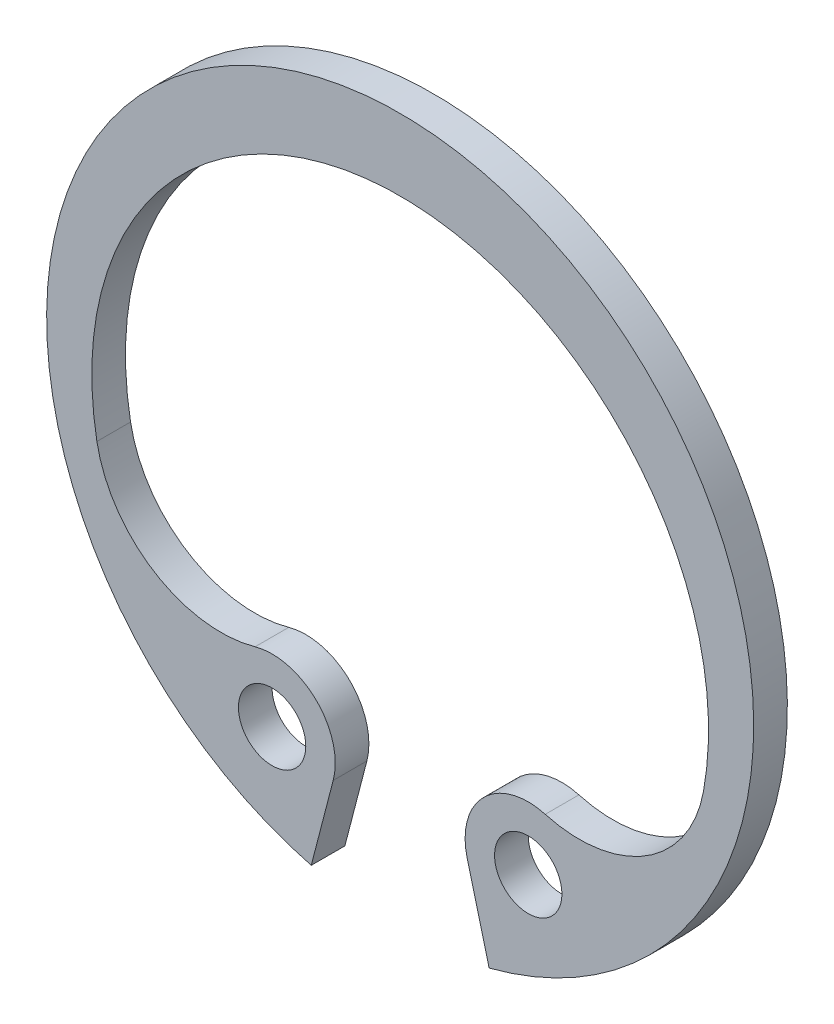
from build123d import *

# Parameters (mm, degrees)
BODYSKE_R  = 0.4
BODY_DEPTH = 0.4


with BuildPart() as part:
    # BodySke → Body (new body)
    with BuildSketch(Plane.XY):
        with BuildLine():
            Line((1.056664408, -4.064905943), (0.795587203, -3.060562204))
            ThreePointArc((0.795587203, -3.060562204), (0.996065873, -2.336654809), (1.723561198, -2.149614265))
            ThreePointArc((1.723561198, -2.149614265), (2.921961798, -1.977591694), (3.602980104, -0.976607263))
            ThreePointArc((3.602980104, -0.976607263), (0, 3.35), (-3.602980104, -0.976607263))
            ThreePointArc((-3.602980104, -0.976607263), (-2.921961798, -1.977591694), (-1.723561198, -2.149614265))
            ThreePointArc((-1.723561198, -2.149614265), (-0.996065873, -2.336654809), (-0.795587203, -3.060562204))
            Line((-0.795587203, -3.060562204), (-1.056664408, -4.064905943))
            ThreePointArc((-1.056664408, -4.064905943), (0, 4.2), (1.056664408, -4.064905943))
        make_face()
        with Locations((1.521463264, -2.871872131)):
            Circle(BODYSKE_R, mode=Mode.SUBTRACT)
        with Locations((-1.521463264, -2.871872131)):
            Circle(BODYSKE_R, mode=Mode.SUBTRACT)
    extrude(amount=-BODY_DEPTH)


solid = part.part
